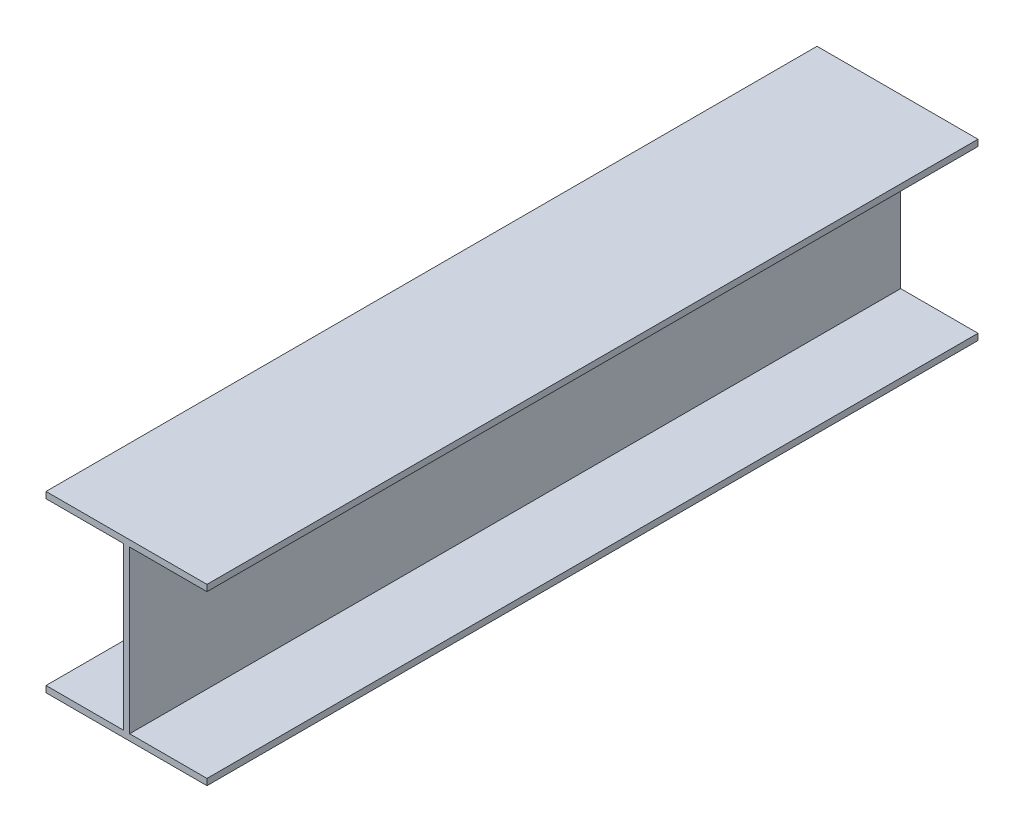
from build123d import *

# Parameters (mm, degrees)
BOSS_EXTRUDE1_DEPTH = 730


with BuildPart() as part:
    # Sketch1 → Boss-Extrude1 (new body)
    with BuildSketch(Plane.XY):
        Polygon((3, -76.55), (76.2, -76.55), (76.2, -82.55), (-76.2, -82.55), (-76.2, -76.55), (-3, -76.55), (-3, 76.55), (-76.2, 76.55), (-76.2, 82.55), (76.2, 82.55), (76.2, 76.55), (3, 76.55), align=None)
    extrude(amount=BOSS_EXTRUDE1_DEPTH)


solid = part.part
